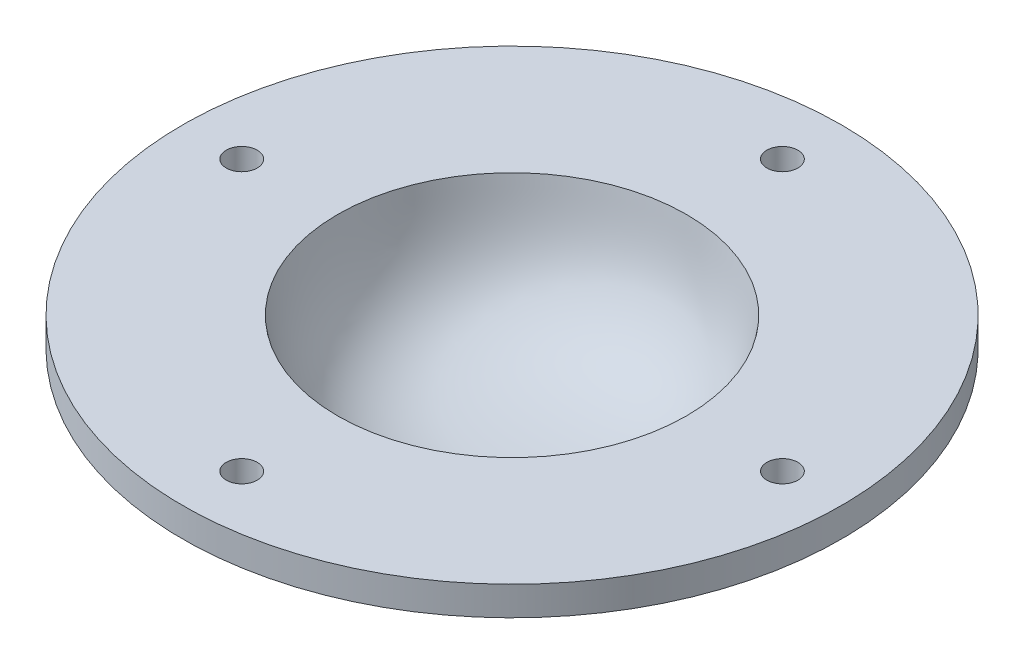
from build123d import *

# Parameters (mm, degrees)
SKETCH3_W          = 13.453428953
SKETCH3_H          = 3
FILLET1_R          = 1.5
SKETCH4_R          = 1.6
CUT_EXTRUDE1_DEPTH = 51.079936266
CIRPATTERN1_COUNT  = 4


with BuildPart() as part:
    # Sketch1 → Revolve1 (revolve)
    with BuildSketch(Plane.XY, mode=Mode.PRIVATE) as revolve1_sk:
        with BuildLine():
            Line((0, -17), (0, -14))
            add(Edge.make_bspline(
                [(0, -14), (16.389539142, -14), (17.019517421, -6.054809845), (18, 0)],
                knots=[0, 0, 0, 0, 1, 1, 1, 1], degree=3))
            Line((18, 0), (20.961422891, 0))
            Line((20.961422891, 0), (20.961422891, -0.479556523))
            add(Edge.make_bspline(
                [(0, -17), (0.528573753, -17), (1.605388754, -16.983569549), (3.600168077, -16.886379692), (5.915984959, -16.646675198), (8.402442715, -16.175166648), (11.369715767, -15.30568509), (14.467863823, -13.768247798), (17.226954494, -11.272431323), (19.016831185, -8.41451175), (20.041971454, -5.53113124), (20.509739393, -3.277227242), (20.784228644, -1.605380322), (20.899427173, -0.862400942), (20.961422891, -0.479556523)],
                knots=[0, 0, 0, 0, 0.03125, 0.0625, 0.125, 0.1875, 0.25, 0.375, 0.5, 0.625, 0.75, 0.875, 0.9375, 1, 1, 1, 1], degree=3))
        make_face()
    revolve(revolve1_sk.sketch.rotate(Axis((0, -17, 0), (0, 1, 0)), 90), axis=Axis((0, -17, 0), (0, 1, 0)))

    # Sketch3 → Revolve2 (revolve)
    with BuildSketch(Plane.XY, mode=Mode.PRIVATE) as revolve2_sk:
        with Locations((27.273285524, -1.5)):
            Rectangle(SKETCH3_W, SKETCH3_H)
    revolve(revolve2_sk.sketch.rotate(Axis((0, 0, 0), (0, 1, 0)), 90), axis=Axis((0, 0, 0), (0, 1, 0)))

    # Fillet1
    fillet1_edges = [part.edges().sort_by_distance(p)[0] for p in [
        (0, -3, 20.546571047),
    ]]
    fillet(fillet1_edges, radius=FILLET1_R)

    # Sketch4 → Cut-Extrude1 (cut, through all)
    with BuildSketch(Plane.XZ.offset(3)):
        with Locations(Location((0, -27.888022688, 0), (0, 0, 270))):
            Circle(SKETCH4_R)
    cut_extrude1 = extrude(amount=-CUT_EXTRUDE1_DEPTH, mode=Mode.SUBTRACT)

    # CirPattern1: Cut-Extrude1 ×4 about axis
    cirpattern1_axis = Axis((0, 0, 0), (0, 1, 0))
    for i in range(1, CIRPATTERN1_COUNT):
        add(cut_extrude1.rotate(cirpattern1_axis, i * 360 / CIRPATTERN1_COUNT), mode=Mode.SUBTRACT)


solid = part.part
